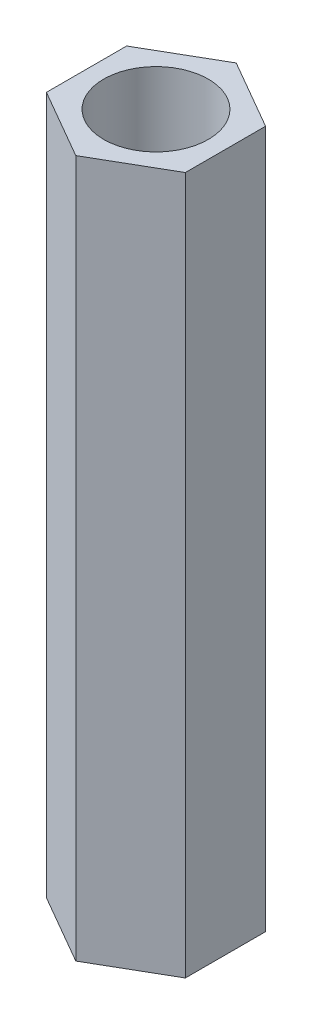
from build123d import *

# Parameters (mm, degrees)
SKETCH_1_R      = 1.5
EXTRUDE_1_DEPTH = 20


with BuildPart() as part:
    # 草图1 → 凸台-拉伸1 (new body)
    with BuildSketch(Plane(origin=(0, 0, 0), x_dir=(1, 0, 0), z_dir=(0, 1, 0))):
        Polygon((0, 2.3), (-1.991858429, 1.15), (-1.991858429, -1.15), (0, -2.3), (1.991858429, -1.15), (1.991858429, 1.15), align=None)
        with Locations(Location((0, 0, 0), (0, 0, 270))):
            Circle(SKETCH_1_R, mode=Mode.SUBTRACT)
    extrude(amount=EXTRUDE_1_DEPTH)


solid = part.part
